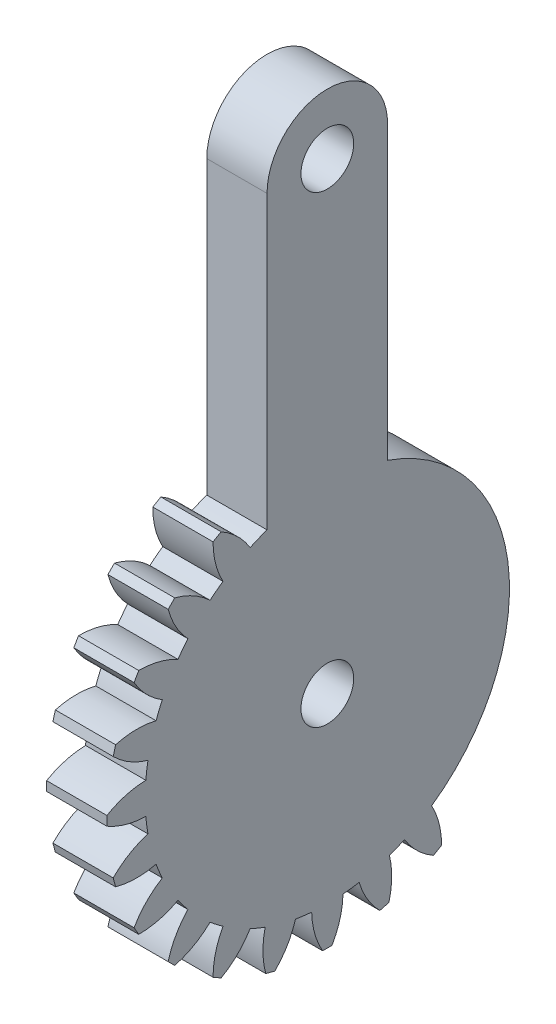
from build123d import *

# Parameters (mm, degrees)
SKETCH1_R           = 1.75
BOSS_EXTRUDE1_DEPTH = 4


with BuildPart() as part:
    # Sketch1 → Boss-Extrude1 (new body)
    with BuildSketch(Plane.YZ):
        with BuildLine():
            Line((-0.31, 14.63), (0.31, 14.63))
            ThreePointArc((0.31, 14.63), (0.838273314, 13.383704325), (1.04, 12.04518576))
            ThreePointArc((1.04, 12.04518576), (1.578061664, 11.986568374), (2.112960617, 11.903927815))
            ThreePointArc((2.112960617, 11.903927815), (2.65424773, 13.144626757), (3.487085624, 14.211728743))
            Line((3.487085624, 14.211728743), (4.085959636, 14.051260935))
            ThreePointArc((4.085959636, 14.051260935), (4.273667417, 12.71070456), (4.122086336, 11.365584201))
            ThreePointArc((4.122086336, 11.365584201), (4.626642697, 11.169703548), (5.12192646, 10.951436862))
            ThreePointArc((5.12192646, 10.951436862), (5.965886177, 12.009764599), (7.046532125, 12.824951657))
            Line((7.046532125, 12.824951657), (7.583467875, 12.514951657))
            ThreePointArc((7.583467875, 12.514951657), (7.417818147, 11.171491285), (6.9232593, 9.911436862))
            ThreePointArc((6.9232593, 9.911436862), (7.359925677, 9.591641884), (7.781841479, 9.252623584))
            ThreePointArc((7.781841479, 9.252623584), (8.870959341, 10.05645683), (10.125769107, 10.564175311))
            Line((10.125769107, 10.564175311), (10.564175311, 10.125769107))
            ThreePointArc((10.564175311, 10.125769107), (10.05645683, 8.870959341), (9.252623584, 7.781841479))
            ThreePointArc((9.252623584, 7.781841479), (9.591641884, 7.359925677), (9.911436862, 6.9232593))
            ThreePointArc((9.911436862, 6.9232593), (11.171491285, 7.417818147), (12.514951657, 7.583467875))
            Line((12.514951657, 7.583467875), (12.824951657, 7.046532125))
            ThreePointArc((12.824951657, 7.046532125), (12.009764599, 5.965886177), (10.951436862, 5.12192646))
            ThreePointArc((10.951436862, 5.12192646), (11.194344337, 4.566700654), (11.409123542, 4))
            Line((11.409123542, 4), (30.75, 4))
            ThreePointArc((30.75, 4), (34.75, 0), (30.75, -4))
            Line((30.75, -4), (11.409123542, -4))
            ThreePointArc((11.409123542, -4), (1.642293391, -11.977936902), (-9.911436862, -6.9232593))
            ThreePointArc((-9.911436862, -6.9232593), (-11.171491285, -7.417818147), (-12.514951657, -7.583467875))
            Line((-12.514951657, -7.583467875), (-12.824951657, -7.046532125))
            ThreePointArc((-12.824951657, -7.046532125), (-12.009764599, -5.965886177), (-10.951436862, -5.12192646))
            ThreePointArc((-10.951436862, -5.12192646), (-11.169703548, -4.626642697), (-11.365584201, -4.122086336))
            ThreePointArc((-11.365584201, -4.122086336), (-12.71070456, -4.273667417), (-14.051260935, -4.085959636))
            Line((-14.051260935, -4.085959636), (-14.211728743, -3.487085624))
            ThreePointArc((-14.211728743, -3.487085624), (-13.144626757, -2.65424773), (-11.903927815, -2.112960617))
            ThreePointArc((-11.903927815, -2.112960617), (-11.986568374, -1.578061664), (-12.04518576, -1.04))
            ThreePointArc((-12.04518576, -1.04), (-13.383704325, -0.838273314), (-14.63, -0.31))
            Line((-14.63, -0.31), (-14.63, 0.31))
            ThreePointArc((-14.63, 0.31), (-13.383704325, 0.838273314), (-12.04518576, 1.04))
            ThreePointArc((-12.04518576, 1.04), (-11.986568374, 1.578061664), (-11.903927815, 2.112960617))
            ThreePointArc((-11.903927815, 2.112960617), (-13.144626757, 2.65424773), (-14.211728743, 3.487085624))
            Line((-14.211728743, 3.487085624), (-14.051260935, 4.085959636))
            ThreePointArc((-14.051260935, 4.085959636), (-12.71070456, 4.273667417), (-11.365584201, 4.122086336))
            ThreePointArc((-11.365584201, 4.122086336), (-11.169703548, 4.626642697), (-10.951436862, 5.12192646))
            ThreePointArc((-10.951436862, 5.12192646), (-12.009764599, 5.965886177), (-12.824951657, 7.046532125))
            Line((-12.824951657, 7.046532125), (-12.514951657, 7.583467875))
            ThreePointArc((-12.514951657, 7.583467875), (-11.171491285, 7.417818147), (-9.911436862, 6.9232593))
            ThreePointArc((-9.911436862, 6.9232593), (-9.591641884, 7.359925677), (-9.252623584, 7.781841479))
            ThreePointArc((-9.252623584, 7.781841479), (-10.05645683, 8.870959341), (-10.564175311, 10.125769107))
            Line((-10.564175311, 10.125769107), (-10.125769107, 10.564175311))
            ThreePointArc((-10.125769107, 10.564175311), (-8.870959341, 10.05645683), (-7.781841479, 9.252623584))
            ThreePointArc((-7.781841479, 9.252623584), (-7.359925677, 9.591641884), (-6.9232593, 9.911436862))
            ThreePointArc((-6.9232593, 9.911436862), (-7.417818147, 11.171491285), (-7.583467875, 12.514951657))
            Line((-7.583467875, 12.514951657), (-7.046532125, 12.824951657))
            ThreePointArc((-7.046532125, 12.824951657), (-5.965886177, 12.009764599), (-5.12192646, 10.951436862))
            ThreePointArc((-5.12192646, 10.951436862), (-4.626642697, 11.169703548), (-4.122086336, 11.365584201))
            ThreePointArc((-4.122086336, 11.365584201), (-4.273667417, 12.71070456), (-4.085959636, 14.051260935))
            Line((-4.085959636, 14.051260935), (-3.487085624, 14.211728743))
            ThreePointArc((-3.487085624, 14.211728743), (-2.65424773, 13.144626757), (-2.112960617, 11.903927815))
            ThreePointArc((-2.112960617, 11.903927815), (-1.578061664, 11.986568374), (-1.04, 12.04518576))
            ThreePointArc((-1.04, 12.04518576), (-0.838273314, 13.383704325), (-0.31, 14.63))
        make_face()
        with Locations(Location((0, 0, 0), (0, 0, 270))):
            Circle(SKETCH1_R, mode=Mode.SUBTRACT)
        with Locations(Location((30.75, 0, 0), (0, 0, 270))):
            Circle(SKETCH1_R, mode=Mode.SUBTRACT)
    extrude(amount=BOSS_EXTRUDE1_DEPTH)


solid = part.part
